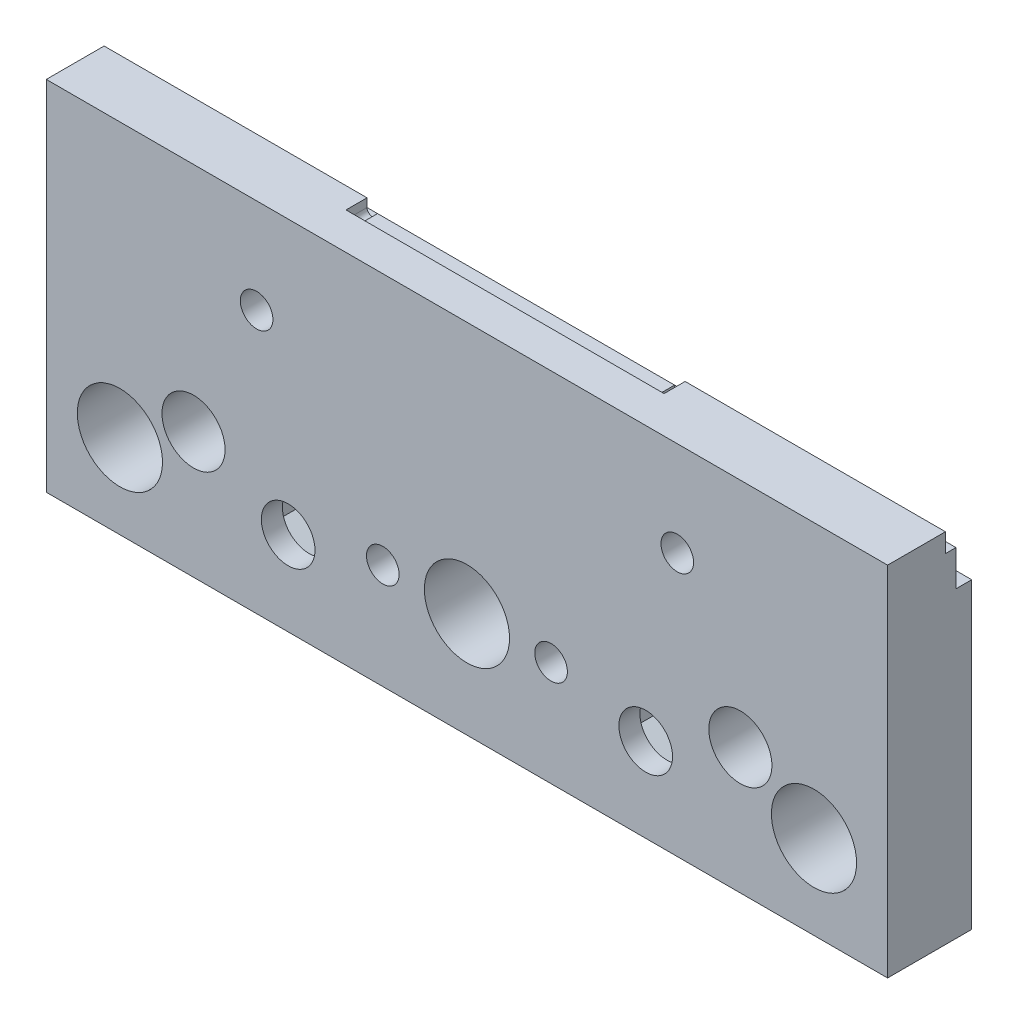
from build123d import *

# Parameters (mm, degrees)
SKETCH_2_W           = 80
SKETCH_2_H           = 34
SKETCH_2_R           = 4.05
EXTRUDE_1_DEPTH      = 8
SKETCH_3_R           = 2.55
CUT_EXTRUDE_1_DEPTH  = 88.292611371
CUT_EXTRUDE_2_DEPTH  = 88.292611371
SKETCH_5_R           = 1.55
CUT_EXTRUDE_3_DEPTH  = 88.292611371
CUT_EXTRUDE_15_DEPTH = 4.5
SKETCH_11_R          = 1.55
CUT_EXTRUDE_7_DEPTH  = 88.292611371
CUT_EXTRUDE_11_DEPTH = 2
SKETCH_21_R          = 3
CUT_EXTRUDE_13_DEPTH = 88.292611371
CUT_EXTRUDE_14_DEPTH = 6


with BuildPart() as part:
    # 草图2 → 凸台-拉伸1 (new body)
    with BuildSketch(Plane.XY):
        with Locations((40, 17)):
            Rectangle(SKETCH_2_W, SKETCH_2_H)
        with Locations((7, 8)):
            Circle(SKETCH_2_R, mode=Mode.SUBTRACT)
        with Locations((40, 10)):
            Circle(SKETCH_2_R, mode=Mode.SUBTRACT)
        with Locations((73, 8)):
            Circle(SKETCH_2_R, mode=Mode.SUBTRACT)
    extrude(amount=EXTRUDE_1_DEPTH)

    # 草图3 → 切除-拉伸1 (cut, through all)
    with BuildSketch(Plane.XY.offset(8)):
        with Locations((23, 8)):
            Circle(SKETCH_3_R)
        with Locations((57, 8)):
            Circle(SKETCH_3_R)
    extrude(amount=-CUT_EXTRUDE_1_DEPTH, mode=Mode.SUBTRACT)

    # 草图4 → 切除-拉伸2 (cut, through all)
    with BuildSketch(Plane(origin=(80, 0, 0), x_dir=(0, 0, -1), z_dir=(1, 0, 0))):
        Polygon((-1.5, 32.2), (-2.5, 32.2), (-2.5, 34), (0, 34), (0, 28.8), (-1.5, 28.8), align=None)
    extrude(amount=-CUT_EXTRUDE_2_DEPTH, mode=Mode.SUBTRACT)

    # 草图5 → 切除-拉伸3 (cut, through all)
    with BuildSketch(Plane.XY.offset(8)):
        with Locations((48, 10)):
            Circle(SKETCH_5_R)
        with Locations((32, 10)):
            Circle(SKETCH_5_R)
    extrude(amount=-CUT_EXTRUDE_3_DEPTH, mode=Mode.SUBTRACT)

    # 草图8 → 切除-拉伸15 (cut)
    with BuildSketch(Plane(origin=(0, 0, 0), x_dir=(-1, 0, 0), z_dir=(0, 0, -1))):
        Polygon((-48, 6.709103466), (-45.15, 8.354551733), (-45.15, 11.645448267), (-48, 13.290896534), (-50.85, 11.645448267), (-50.85, 8.354551733), align=None)
        Polygon((-34.85, 11.645448267), (-34.85, 8.354551733), (-32, 6.709103466), (-29.15, 8.354551733), (-29.15, 11.645448267), (-32, 13.290896534), align=None)
    extrude(amount=-CUT_EXTRUDE_15_DEPTH, mode=Mode.SUBTRACT)

    # 草图11 → 切除-拉伸7 (cut, through all)
    with BuildSketch(Plane(origin=(0, 0, 0), x_dir=(-1, 0, 0), z_dir=(0, 0, -1))):
        with Locations((-60, 25)):
            Circle(SKETCH_11_R)
        with Locations((-20, 25)):
            Circle(SKETCH_11_R)
    extrude(amount=-CUT_EXTRUDE_7_DEPTH, mode=Mode.SUBTRACT)

    # 草图19 → 切除-拉伸11 (cut)
    with BuildSketch(Plane(origin=(0, 0, 2.5), x_dir=(-1, 0, 0), z_dir=(0, 0, -1))):
        with BuildLine():
            Line((-25, 34), (-55.247938178, 34))
            Line((-55.247938178, 34), (-55.247938178, 33.2))
            ThreePointArc((-55.247938178, 33.2), (-54.747938178, 32.7), (-54.247938178, 33.2))
            Line((-54.247938178, 33.2), (-26, 33.2))
            ThreePointArc((-26, 33.2), (-25.5, 32.7), (-25, 33.2))
            Line((-25, 33.2), (-25, 34))
        make_face()
    extrude(amount=-CUT_EXTRUDE_11_DEPTH, mode=Mode.SUBTRACT)

    # 草图21 → 切除-拉伸13 (cut, through all)
    with BuildSketch(Plane(origin=(0, 0, 0), x_dir=(-1, 0, 0), z_dir=(0, 0, -1))):
        with Locations((-66, 12)):
            Circle(SKETCH_21_R)
        with Locations(Location((-14, 12, 0), (0, 0, 180))):
            Circle(SKETCH_21_R)
    extrude(amount=-CUT_EXTRUDE_13_DEPTH, mode=Mode.SUBTRACT)

    # 草图22 → 切除-拉伸14 (cut)
    with BuildSketch(Plane(origin=(0, 0, 0), x_dir=(-1, 0, 0), z_dir=(0, 0, -1))):
        Polygon((-52.9, 5.632863896), (-52.9, 10.367136104), (-57, 12.734272207), (-61.1, 10.367136104), (-61.1, 5.632863896), (-57, 3.265727793), align=None)
        Polygon((-23, 3.265727793), (-18.9, 5.632863896), (-18.9, 10.367136104), (-23, 12.734272207), (-27.1, 10.367136104), (-27.1, 5.632863896), align=None)
    extrude(amount=-CUT_EXTRUDE_14_DEPTH, mode=Mode.SUBTRACT)


solid = part.part
